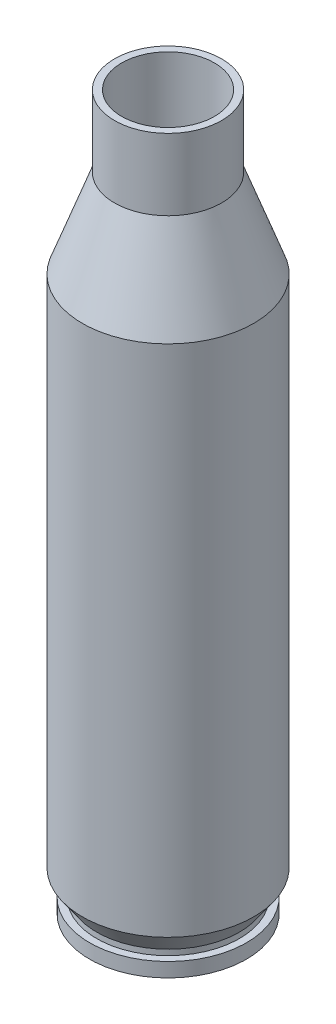
from build123d import *


with BuildPart() as part:
    # Esquisse1 → Révolution1 (revolve)
    with BuildSketch(Plane.XY, mode=Mode.PRIVATE) as r_volution1_sk:
        Polygon((-3.25, 50), (-3.75, 50), (-3.75, 45), (-6, 38.818175806), (-6, 2.818175806), (-5, 1.390027799), (-5, 1), (-5.5, 1), (-5.5, 0), (0, 0), (0, 1), (-4.389612706, 1), (-4.389612706, 1.390027799), (-5.389612706, 2.818175806), (-5.389612706, 39.033298915), (-3.25, 44.91183651), align=None)
    revolve(r_volution1_sk.sketch.rotate(Axis((0, 0, 0), (0, 1, 0)), 270), axis=Axis((0, 0, 0), (0, 1, 0)))


solid = part.part
